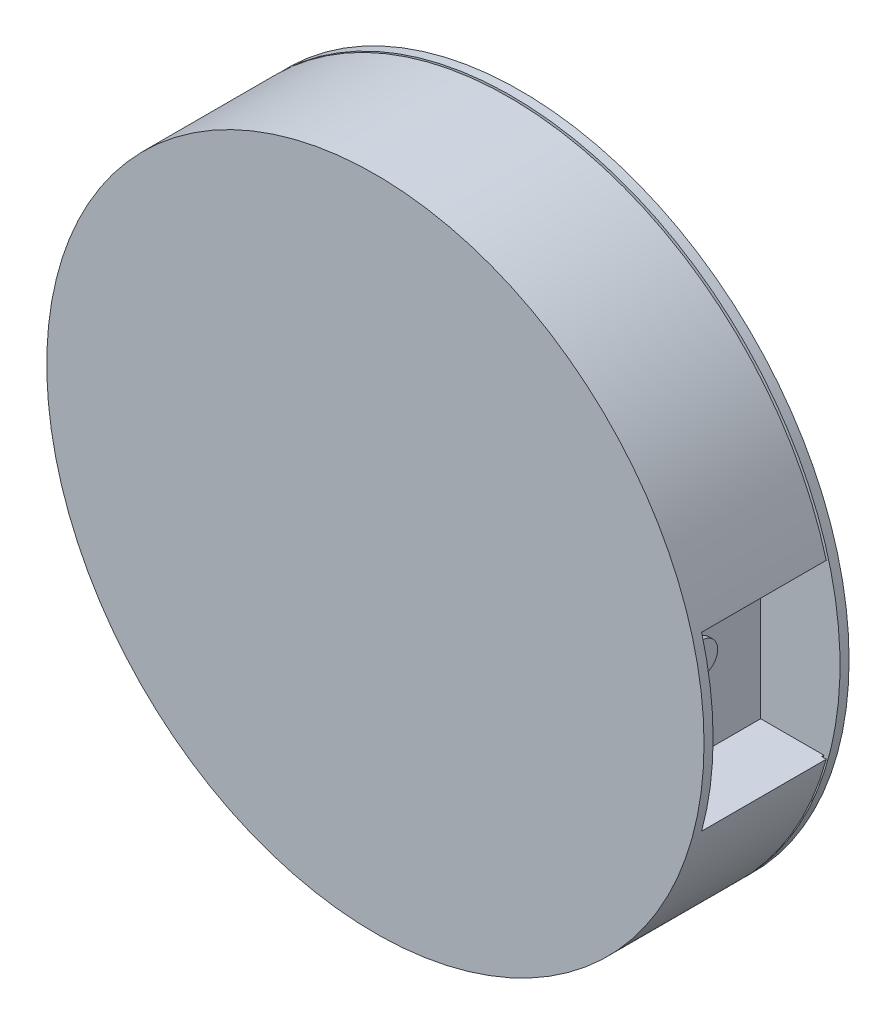
from build123d import *

# Parameters (mm, degrees)
SKIZZE2_R              = 72.5
BASE_DEPTH             = 32
SKIZZE3_W              = 1
SKIZZE3_H              = 0.5
SKIZZE4_W              = 28
SKIZZE4_H              = 38
FRONT_CAMERA_CUT_DEPTH = 17.5
SKIZZE5_W              = 1
SKIZZE5_H              = 38
FRONT_DETAIL_DEPTH     = 1
SKIZZE6_R              = 3.5
CAMERA_DETAIL_DEPTH    = 1


with BuildPart() as part:
    # Skizze2 → Base (new body)
    with BuildSketch(Plane.XY):
        Circle(SKIZZE2_R)
    extrude(amount=BASE_DEPTH)

    # Skizze3 → Cover Seam (revolve, cut)
    with BuildSketch(Plane(origin=(0, 0, 0), x_dir=(1, 0, 0), z_dir=(0, 1, 0)), mode=Mode.PRIVATE) as cover_seam_sk:
        with Locations((72, -2.25)):
            Rectangle(SKIZZE3_W, SKIZZE3_H)
    revolve(cover_seam_sk.sketch.rotate(Axis((0, 0, 0), (0, 0, 1)), 180), axis=Axis((0, 0, 0), (0, 0, 1)), mode=Mode.SUBTRACT)

    # Skizze4 → Front Camera Cut (cut)
    with BuildSketch(Plane(origin=(72.5, 0, 0), x_dir=(0, 0, -1), z_dir=(1, 0, 0))):
        with Locations((-16, 0)):
            Rectangle(SKIZZE4_W, SKIZZE4_H)
    extrude(amount=-FRONT_CAMERA_CUT_DEPTH, mode=Mode.SUBTRACT)

    # Skizze5 → Front Detail (cut)
    with BuildSketch(Plane(origin=(55, 0, 0), x_dir=(0, 0, -1), z_dir=(1, 0, 0))):
        with Locations((-29.5, 0)):
            Rectangle(SKIZZE5_W, SKIZZE5_H)
    extrude(amount=-FRONT_DETAIL_DEPTH, mode=Mode.SUBTRACT)

    # Skizze6 → Camera Detail (add)
    with BuildSketch(Plane(origin=(55, 0, 0), x_dir=(0, 0, -1), z_dir=(1, 0, 0))):
        with Locations(Location((-16, 0, 0), (0, 0, 180))):
            Circle(SKIZZE6_R)
    extrude(amount=CAMERA_DETAIL_DEPTH)


solid = part.part
